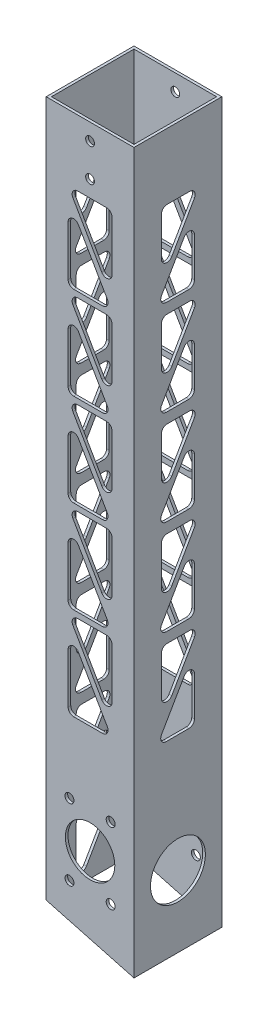
from build123d import *

# Parameters (mm, degrees)
SKETCH1_W               = 50.8
SKETCH1_H               = 50.8
SKETCH1_W_2             = 47.752
SKETCH1_H_2             = 47.752
EXTRUDE_THIN1_DEPTH     = 415.925
CUT_EXTRUDE1_DEPTH      = 418.473263365
CUT_EXTRUDE1_DEPTH_BACK = 418.473263365
SKETCH2_R               = 14.3002
SKETCH2_R_2             = 2.5908
SKETCH3_R               = 15.875
CUT_EXTRUDE2_DEPTH      = 1.524
F_10_CLEARANCE_HOLE1_D  = 5.1054
CUT_EXTRUDE3_DEPTH      = 420.784951642
CUT_EXTRUDE4_DEPTH      = 420.784951642
CUT_EXTRUDE5_DEPTH      = 1.524
CUT_EXTRUDE6_DEPTH      = 420.784951642


with BuildPart() as part:
    # Sketch1 → Extrude-Thin1 (new body)
    with BuildSketch(Plane(origin=(0, 0, 0), x_dir=(1, 0, 0), z_dir=(0, 1, 0))):
        Rectangle(SKETCH1_W, SKETCH1_H)
        Rectangle(SKETCH1_W_2, SKETCH1_H_2, mode=Mode.SUBTRACT)
    extrude(amount=EXTRUDE_THIN1_DEPTH)

    # Sketch2 → Cut-Extrude1 (cut, two sides: drawn at the far end of the back side and taken through both)
    with BuildSketch(Plane.XY.offset(-CUT_EXTRUDE1_DEPTH_BACK)):
        with Locations((0, 50.8)):
            Circle(SKETCH2_R)
        with Locations((-11.90625, 30.177770072)):
            Circle(SKETCH2_R_2)
        with Locations((11.90625, 30.177770072)):
            Circle(SKETCH2_R_2)
        with Locations((11.90625, 71.422229928)):
            Circle(SKETCH2_R_2)
        with Locations((-11.90625, 71.422229928)):
            Circle(SKETCH2_R_2)
    extrude(amount=CUT_EXTRUDE1_DEPTH + CUT_EXTRUDE1_DEPTH_BACK, mode=Mode.SUBTRACT)

    # Sketch3 → Cut-Extrude2 (cut)
    with BuildSketch(Plane(origin=(25.4, 0, 0), x_dir=(0, 0, -1), z_dir=(1, 0, 0))):
        with Locations((0, 41.275)):
            Circle(SKETCH3_R)
    extrude(amount=-CUT_EXTRUDE2_DEPTH, mode=Mode.SUBTRACT)

    # #10 Clearance Hole1 (through all)
    with Locations(Plane.XY.offset(25.4)):
        with Locations((0, 387.35), (0, 406.4)):
            Hole(F_10_CLEARANCE_HOLE1_D / 2)

    # Sketch7 → Cut-Extrude3 (cut, through all)
    with BuildSketch(Plane.XY.offset(25.4)):
        with BuildLine():
            Line((-7.200738686, 377.825), (9.525, 377.825))
            ThreePointArc((9.525, 377.825), (11.77006403, 376.89506403), (12.7, 374.65))
            Line((12.7, 374.65), (12.7, 345.680170802))
            ThreePointArc((12.7, 345.680170802), (10.346750468, 342.613356303), (6.775369343, 344.092670802))
            Line((6.775369343, 344.092670802), (-9.950369343, 373.0625))
            ThreePointArc((-9.950369343, 373.0625), (-9.950369343, 376.2375), (-7.200738686, 377.825))
        make_face()
        with BuildLine():
            Line((-9.525, 327.480909488), (7.200738686, 327.480909488))
            ThreePointArc((7.200738686, 327.480909488), (9.950369343, 329.068409488), (9.950369343, 332.243409488))
            Line((9.950369343, 332.243409488), (-6.775369343, 361.213238686))
            ThreePointArc((-6.775369343, 361.213238686), (-10.346750468, 362.692553184), (-12.7, 359.625738686))
            Line((-12.7, 359.625738686), (-12.7, 330.655909488))
            ThreePointArc((-12.7, 330.655909488), (-11.77006403, 328.410845457), (-9.525, 327.480909488))
        make_face()
        with BuildLine():
            Line((-7.200738686, 324.305909488), (9.525, 324.305909488))
            ThreePointArc((9.525, 324.305909488), (11.77006403, 323.375973518), (12.7, 321.130909488))
            Line((12.7, 321.130909488), (12.7, 292.16108029))
            ThreePointArc((12.7, 292.16108029), (10.346750468, 289.094265791), (6.775369343, 290.57358029))
            Line((6.775369343, 290.57358029), (-9.950369343, 319.543409488))
            ThreePointArc((-9.950369343, 319.543409488), (-9.950369343, 322.718409488), (-7.200738686, 324.305909488))
        make_face()
        with BuildLine():
            Line((-12.7, 277.136818976), (-12.7, 306.106648174))
            ThreePointArc((-12.7, 306.106648174), (-10.346750468, 309.173462672), (-6.775369343, 307.694148174))
            Line((-6.775369343, 307.694148174), (9.950369343, 278.724318976))
            ThreePointArc((9.950369343, 278.724318976), (9.950369343, 275.549318976), (7.200738686, 273.961818976))
            Line((7.200738686, 273.961818976), (-9.525, 273.961818976))
            ThreePointArc((-9.525, 273.961818976), (-11.77006403, 274.891754945), (-12.7, 277.136818976))
        make_face()
        with BuildLine():
            Line((-7.200738686, 270.786818976), (9.525, 270.786818976))
            ThreePointArc((9.525, 270.786818976), (11.77006403, 269.856883006), (12.7, 267.611818976))
            Line((12.7, 267.611818976), (12.7, 238.641989777))
            ThreePointArc((12.7, 238.641989777), (10.346750468, 235.575175279), (6.775369343, 237.054489777))
            Line((6.775369343, 237.054489777), (-9.950369343, 266.024318976))
            ThreePointArc((-9.950369343, 266.024318976), (-9.950369343, 269.199318976), (-7.200738686, 270.786818976))
        make_face()
        with BuildLine():
            Line((-12.7, 223.617728463), (-12.7, 252.587557661))
            ThreePointArc((-12.7, 252.587557661), (-10.346750468, 255.65437216), (-6.775369343, 254.175057661))
            Line((-6.775369343, 254.175057661), (9.950369343, 225.205228463))
            ThreePointArc((9.950369343, 225.205228463), (9.950369343, 222.030228463), (7.200738686, 220.442728463))
            Line((7.200738686, 220.442728463), (-9.525, 220.442728463))
            ThreePointArc((-9.525, 220.442728463), (-11.77006403, 221.372664433), (-12.7, 223.617728463))
        make_face()
        with BuildLine():
            Line((-7.200738686, 217.267728463), (9.525, 217.267728463))
            ThreePointArc((9.525, 217.267728463), (11.77006403, 216.337792494), (12.7, 214.092728463))
            Line((12.7, 214.092728463), (12.7, 185.122899265))
            ThreePointArc((12.7, 185.122899265), (10.346750468, 182.056084767), (6.775369343, 183.535399265))
            Line((6.775369343, 183.535399265), (-9.950369343, 212.505228463))
            ThreePointArc((-9.950369343, 212.505228463), (-9.950369343, 215.680228463), (-7.200738686, 217.267728463))
        make_face()
        with BuildLine():
            Line((-12.7, 170.098637951), (-12.7, 199.068467149))
            ThreePointArc((-12.7, 199.068467149), (-10.346750468, 202.135281648), (-6.775369343, 200.655967149))
            Line((-6.775369343, 200.655967149), (9.950369343, 171.686137951))
            ThreePointArc((9.950369343, 171.686137951), (9.950369343, 168.511137951), (7.200738686, 166.923637951))
            Line((7.200738686, 166.923637951), (-9.525, 166.923637951))
            ThreePointArc((-9.525, 166.923637951), (-11.77006403, 167.853573921), (-12.7, 170.098637951))
        make_face()
        with BuildLine():
            Line((-7.200738686, 163.748637951), (9.525, 163.748637951))
            ThreePointArc((9.525, 163.748637951), (11.77006403, 162.818701981), (12.7, 160.573637951))
            Line((12.7, 160.573637951), (12.7, 131.603808753))
            ThreePointArc((12.7, 131.603808753), (10.346750468, 128.536994254), (6.775369343, 130.016308753))
            Line((6.775369343, 130.016308753), (-9.950369343, 158.986137951))
            ThreePointArc((-9.950369343, 158.986137951), (-9.950369343, 162.161137951), (-7.200738686, 163.748637951))
        make_face()
        with BuildLine():
            Line((-12.7, 116.579547439), (-12.7, 145.549376637))
            ThreePointArc((-12.7, 145.549376637), (-10.346750468, 148.616191135), (-6.775369343, 147.136876637))
            Line((-6.775369343, 147.136876637), (9.950369343, 118.167047439))
            ThreePointArc((9.950369343, 118.167047439), (9.950369343, 114.992047439), (7.200738686, 113.404547439))
            Line((7.200738686, 113.404547439), (-9.525, 113.404547439))
            ThreePointArc((-9.525, 113.404547439), (-11.77006403, 114.334483408), (-12.7, 116.579547439))
        make_face()
    extrude(amount=-CUT_EXTRUDE3_DEPTH, mode=Mode.SUBTRACT)

    # Sketch8 → Cut-Extrude4 (cut, through all)
    with BuildSketch(Plane.ZY.offset(25.4)):
        with BuildLine():
            ThreePointArc((9.525, 223.783805805), (9.525, 220.608805805), (6.775369343, 219.021305805))
            Line((6.775369343, 219.021305805), (-6.35, 219.021305805))
            ThreePointArc((-6.35, 219.021305805), (-8.59506403, 219.951241775), (-9.525, 222.196305805))
            Line((-9.525, 222.196305805), (-9.525, 244.930112376))
            ThreePointArc((-9.525, 244.930112376), (-7.171750468, 247.996926874), (-3.600369343, 246.517612376))
            Line((-3.600369343, 246.517612376), (9.525, 223.783805805))
        make_face()
        with BuildLine():
            ThreePointArc((-9.525, 263.12937369), (-9.525, 266.30437369), (-6.775369343, 267.89187369))
            Line((-6.775369343, 267.89187369), (6.35, 267.89187369))
            ThreePointArc((6.35, 267.89187369), (8.59506403, 266.96193772), (9.525, 264.71687369))
            Line((9.525, 264.71687369), (9.525, 241.983067119))
            ThreePointArc((9.525, 241.983067119), (7.171750468, 238.916252621), (3.600369343, 240.395567119))
            Line((3.600369343, 240.395567119), (-9.525, 263.12937369))
        make_face()
        with BuildLine():
            ThreePointArc((9.525, 278.750368961), (9.525, 275.575368961), (6.775369343, 273.987868961))
            Line((6.775369343, 273.987868961), (-6.35, 273.987868961))
            ThreePointArc((-6.35, 273.987868961), (-8.59506403, 274.91780493), (-9.525, 277.162868961))
            Line((-9.525, 277.162868961), (-9.525, 299.896675531))
            ThreePointArc((-9.525, 299.896675531), (-7.171750468, 302.963490029), (-3.600369343, 301.484175531))
            Line((-3.600369343, 301.484175531), (9.525, 278.750368961))
        make_face()
        with BuildLine():
            ThreePointArc((-9.525, 318.095936845), (-9.525, 321.270936845), (-6.775369343, 322.858436845))
            Line((-6.775369343, 322.858436845), (6.35, 322.858436845))
            ThreePointArc((6.35, 322.858436845), (8.59506403, 321.928500875), (9.525, 319.683436845))
            Line((9.525, 319.683436845), (9.525, 296.949630275))
            ThreePointArc((9.525, 296.949630275), (7.171750468, 293.882815776), (3.600369343, 295.362130275))
            Line((3.600369343, 295.362130275), (-9.525, 318.095936845))
        make_face()
        with BuildLine():
            Line((-9.525, 332.129432116), (-9.525, 354.863238686))
            ThreePointArc((-9.525, 354.863238686), (-7.171750468, 357.930053184), (-3.600369343, 356.450738686))
            Line((-3.600369343, 356.450738686), (9.525, 333.716932116))
            ThreePointArc((9.525, 333.716932116), (9.525, 330.541932116), (6.775369343, 328.954432116))
            Line((6.775369343, 328.954432116), (-6.35, 328.954432116))
            ThreePointArc((-6.35, 328.954432116), (-8.59506403, 329.884368086), (-9.525, 332.129432116))
        make_face()
        with BuildLine():
            ThreePointArc((9.525, 351.91619343), (7.171750468, 348.849378931), (3.600369343, 350.32869343))
            Line((3.600369343, 350.32869343), (-9.525, 373.0625))
            ThreePointArc((-9.525, 373.0625), (-9.525, 376.2375), (-6.775369343, 377.825))
            Line((-6.775369343, 377.825), (6.35, 377.825))
            ThreePointArc((6.35, 377.825), (8.59506403, 376.89506403), (9.525, 374.65))
            Line((9.525, 374.65), (9.525, 351.91619343))
        make_face()
        with BuildLine():
            ThreePointArc((-9.525, 208.162810534), (-9.525, 211.337810534), (-6.775369343, 212.925310534))
            Line((-6.775369343, 212.925310534), (6.35, 212.925310534))
            ThreePointArc((6.35, 212.925310534), (8.59506403, 211.995374565), (9.525, 209.750310534))
            Line((9.525, 209.750310534), (9.525, 187.016503964))
            ThreePointArc((9.525, 187.016503964), (7.171750468, 183.949689466), (3.600369343, 185.429003964))
            Line((3.600369343, 185.429003964), (-9.525, 208.162810534))
        make_face()
        with BuildLine():
            ThreePointArc((9.525, 168.81724265), (9.525, 165.64224265), (6.775369343, 164.05474265))
            Line((6.775369343, 164.05474265), (-6.35, 164.05474265))
            ThreePointArc((-6.35, 164.05474265), (-8.59506403, 164.98467862), (-9.525, 167.22974265))
            Line((-9.525, 167.22974265), (-9.525, 189.96354922))
            ThreePointArc((-9.525, 189.96354922), (-7.171750468, 193.030363719), (-3.600369343, 191.55104922))
            Line((-3.600369343, 191.55104922), (9.525, 168.81724265))
        make_face()
        with BuildLine():
            ThreePointArc((-9.525, 153.196247379), (-9.525, 156.371247379), (-6.775369343, 157.958747379))
            Line((-6.775369343, 157.958747379), (6.35, 157.958747379))
            ThreePointArc((6.35, 157.958747379), (8.59506403, 157.028811409), (9.525, 154.783747379))
            Line((9.525, 154.783747379), (9.525, 132.049940809))
            ThreePointArc((9.525, 132.049940809), (7.171750468, 128.98312631), (3.600369343, 130.462440809))
            Line((3.600369343, 130.462440809), (-9.525, 153.196247379))
        make_face()
        with BuildLine():
            ThreePointArc((9.525, 113.850679495), (9.525, 110.675679495), (6.775369343, 109.088179495))
            Line((6.775369343, 109.088179495), (-6.35, 109.088179495))
            ThreePointArc((-6.35, 109.088179495), (-8.59506403, 110.018115465), (-9.525, 112.263179495))
            Line((-9.525, 112.263179495), (-9.525, 134.996986065))
            ThreePointArc((-9.525, 134.996986065), (-7.171750468, 138.063800564), (-3.600369343, 136.584486065))
            Line((-3.600369343, 136.584486065), (9.525, 113.850679495))
        make_face()
    extrude(amount=-CUT_EXTRUDE4_DEPTH, mode=Mode.SUBTRACT)

    # Sketch8<4> → Cut-Extrude5 (cut)
    with BuildSketch(Plane.ZY.offset(25.4)):
        with BuildLine():
            ThreePointArc((-9.525, 43.263121069), (-9.525, 46.438121069), (-6.775369343, 48.025621069))
            Line((-6.775369343, 48.025621069), (6.35, 48.025621069))
            ThreePointArc((6.35, 48.025621069), (8.59506403, 47.095685099), (9.525, 44.850621069))
            Line((9.525, 44.850621069), (9.525, 22.116814498))
            ThreePointArc((9.525, 22.116814498), (7.171750468, 19.05), (3.600369343, 20.529314498))
            Line((3.600369343, 20.529314498), (-9.525, 43.263121069))
        make_face()
        with BuildLine():
            ThreePointArc((9.525, 58.88411634), (9.525, 55.70911634), (6.775369343, 54.12161634))
            Line((6.775369343, 54.12161634), (-6.35, 54.12161634))
            ThreePointArc((-6.35, 54.12161634), (-8.59506403, 55.051552309), (-9.525, 57.29661634))
            Line((-9.525, 57.29661634), (-9.525, 80.03042291))
            ThreePointArc((-9.525, 80.03042291), (-7.171750468, 83.097237408), (-3.600369343, 81.61792291))
            Line((-3.600369343, 81.61792291), (9.525, 58.88411634))
        make_face()
        with BuildLine():
            ThreePointArc((-9.525, 98.229684224), (-9.525, 101.404684224), (-6.775369343, 102.992184224))
            Line((-6.775369343, 102.992184224), (6.35, 102.992184224))
            ThreePointArc((6.35, 102.992184224), (8.59506403, 102.062248254), (9.525, 99.817184224))
            Line((9.525, 99.817184224), (9.525, 77.083377654))
            ThreePointArc((9.525, 77.083377654), (7.171750468, 74.016563155), (3.600369343, 75.495877654))
            Line((3.600369343, 75.495877654), (-9.525, 98.229684224))
        make_face()
        with BuildLine():
            Line((3.600369343, 185.429003964), (-9.525, 208.162810534))
            ThreePointArc((-9.525, 208.162810534), (-9.525, 211.337810534), (-6.775369343, 212.925310534))
            Line((-6.775369343, 212.925310534), (6.35, 212.925310534))
            ThreePointArc((6.35, 212.925310534), (8.59506403, 211.995374565), (9.525, 209.750310534))
            Line((9.525, 209.750310534), (9.525, 187.016503964))
            ThreePointArc((9.525, 187.016503964), (7.171750468, 183.949689466), (3.600369343, 185.429003964))
        make_face()
        with BuildLine():
            Line((-6.35, 164.05474265), (6.775369343, 164.05474265))
            ThreePointArc((6.775369343, 164.05474265), (9.525, 165.64224265), (9.525, 168.81724265))
            Line((9.525, 168.81724265), (-3.600369343, 191.55104922))
            ThreePointArc((-3.600369343, 191.55104922), (-7.171750468, 193.030363719), (-9.525, 189.96354922))
            Line((-9.525, 189.96354922), (-9.525, 167.22974265))
            ThreePointArc((-9.525, 167.22974265), (-8.59506403, 164.98467862), (-6.35, 164.05474265))
        make_face()
    extrude(amount=-CUT_EXTRUDE5_DEPTH, mode=Mode.SUBTRACT)

    # Sketch9 → Cut-Extrude6 (cut, through all)
    with BuildSketch(Plane.XY.offset(25.4)):
        Polygon((25.4, 0), (-25.4, 13.611818976), (-25.4, 0), align=None)
    extrude(amount=-CUT_EXTRUDE6_DEPTH, mode=Mode.SUBTRACT)


solid = part.part
